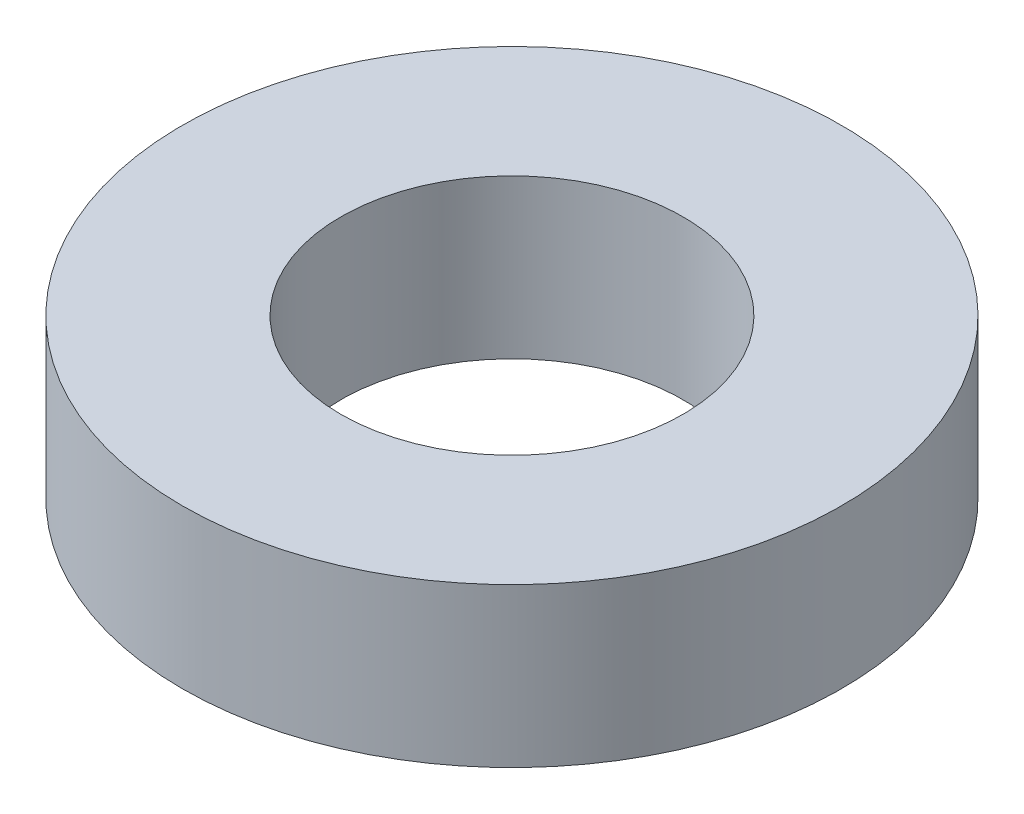
from build123d import *

# Parameters (mm, degrees)
SKETCH1_R           = 6.604
SKETCH1_R_2         = 3.429
BOSS_EXTRUDE1_DEPTH = 3.175


with BuildPart() as part:
    # Sketch1 → Boss-Extrude1 (new body)
    with BuildSketch(Plane(origin=(0, 0, 0), x_dir=(1, 0, 0), z_dir=(0, 1, 0))):
        with Locations(Location((0, 0, 0), (0, 0, 270))):
            Circle(SKETCH1_R)
        with Locations(Location((0, 0, 0), (0, 0, 270))):
            Circle(SKETCH1_R_2, mode=Mode.SUBTRACT)
    extrude(amount=BOSS_EXTRUDE1_DEPTH)


solid = part.part
